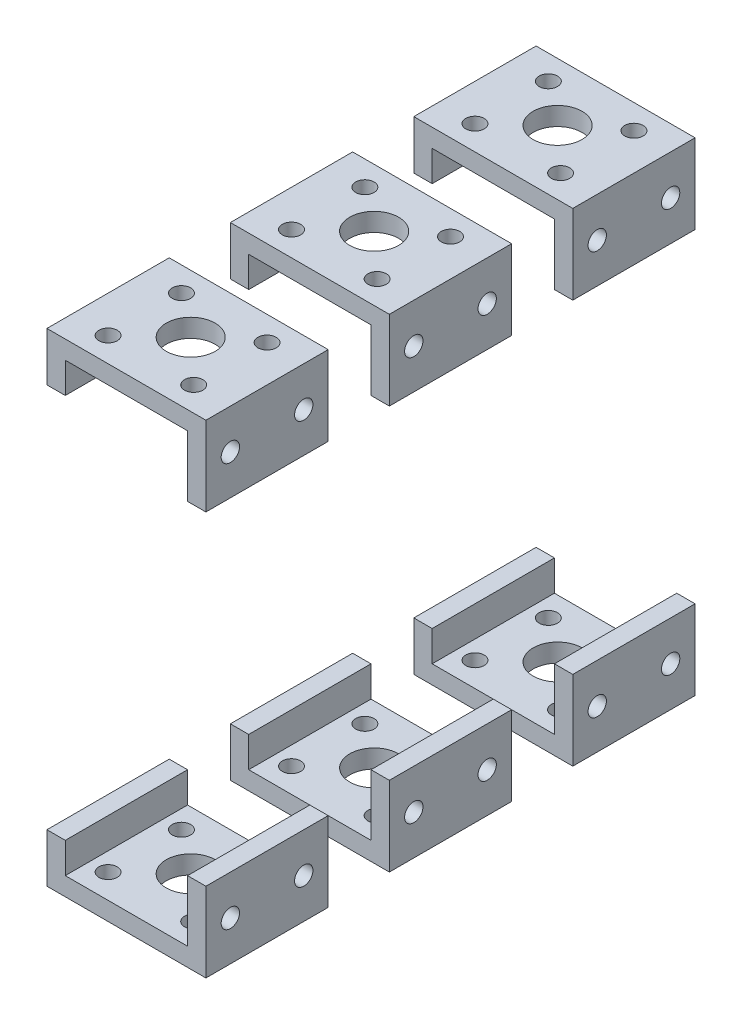
from build123d import *

# Parameters (mm, degrees)
EXTRUDE_1_DEPTH          = 160
CUT_EXTRUDE_2_DEPTH      = 167.400871392
CUT_EXTRUDE_2_DEPTH_BACK = 167.400871392
SKETCH_5_R               = 1.5
CUT_EXTRUDE_3_DEPTH      = 3
SKETCH_6_R               = 1.5
SKETCH_6_R_2             = 4
CUT_EXTRUDE_4_DEPTH      = 3


with BuildPart() as part:
    # 草图1 → 凸台-拉伸1 (new body)
    with BuildSketch(Plane.XY):
        Polygon((-8.639969484, -35.5), (-8.639969484, -39.5), (17.360030516, -39.5), (17.360030516, 39.5), (-8.639969484, 39.5), (-8.639969484, 35.5), (-8.639969484, 31.5), (-5.639969484, 31.5), (-5.639969484, 36.5), (14.360030516, 36.5), (14.360030516, -36.5), (-5.639969484, -36.5), (-5.639969484, -31.5), (-8.639969484, -31.5), align=None)
    extrude(amount=EXTRUDE_1_DEPTH)

    # 草图4 → 切除-拉伸2 (cut, two sides: drawn at the far end of the back side and taken through both)
    with BuildSketch(Plane.ZY.offset(-14.360030516).offset(-CUT_EXTRUDE_2_DEPTH_BACK)):
        Polygon((140, 26.5), (160, 26.5), (160, -26.5), (140, -26.5), (140, -45.304030301), (130, -45.304030301), (130, -26.5), (110, -26.5), (110, -45.304030301), (100, -45.304030301), (100, -26.5), (80, -26.5), (80, -45.304030301), (72.341947093, -45.304030301), (72.341947093, -47.20233834), (-21.576648983, -47.20233834), (-21.576648983, 47.202965292), (72.341947093, 47.202965292), (72.341947093, 45.304030301), (80, 45.304030301), (80, 26.5), (100, 26.5), (100, 45.304030301), (110, 45.304030301), (110, 26.5), (130, 26.5), (130, 45.304030301), (140, 45.304030301), align=None)
    extrude(amount=CUT_EXTRUDE_2_DEPTH + CUT_EXTRUDE_2_DEPTH_BACK, mode=Mode.SUBTRACT)


with BuildPart() as cut_extrude_2_piece_1:
    # of the separate pieces the step leaves, piece 1, a body of its own (cut_extrude_2_pieces)
    add(part.part.solids().sort_by_distance((17.360030516, 39.5, 80))[0])


with BuildPart() as cut_extrude_2_piece_2:
    # of the separate pieces the step leaves, piece 2, a body of its own (cut_extrude_2_pieces)
    add(part.part.solids().sort_by_distance((17.360030516, 39.5, 110))[0])


with BuildPart() as cut_extrude_2_piece_3:
    # of the separate pieces the step leaves, piece 3, a body of its own (cut_extrude_2_pieces)
    add(part.part.solids().sort_by_distance((17.360030516, -39.5, 140))[0])


with BuildPart() as cut_extrude_2_piece_4:
    # of the separate pieces the step leaves, piece 4, a body of its own (cut_extrude_2_pieces)
    add(part.part.solids().sort_by_distance((17.360030516, 39.5, 140))[0])


with BuildPart() as cut_extrude_2_piece_5:
    # of the separate pieces the step leaves, piece 5, a body of its own (cut_extrude_2_pieces)
    add(part.part.solids().sort_by_distance((17.360030516, -39.5, 110))[0])


with BuildPart() as cut_extrude_2_piece_6:
    # of the separate pieces the step leaves, piece 6, a body of its own (cut_extrude_2_pieces)
    add(part.part.solids().sort_by_distance((-8.639969484, -39.5, 80))[0])


with BuildPart() as cut_extrude_3_tool:
    # 草图5 → 切除-拉伸3 (new body)
    with BuildSketch(Plane(origin=(17.360030516, 0, 0), x_dir=(0, 0, -1), z_dir=(1, 0, 0))):
        with Locations(Location((-96, -33, 0), (0, 0, 90))):
            Circle(SKETCH_5_R)
        with Locations(Location((-84, -33, 0), (0, 0, 90))):
            Circle(SKETCH_5_R)
        with Locations(Location((-126, -33, 0), (0, 0, 90))):
            Circle(SKETCH_5_R)
        with Locations(Location((-114, -33, 0), (0, 0, 90))):
            Circle(SKETCH_5_R)
        with Locations(Location((-156, -33, 0), (0, 0, 90))):
            Circle(SKETCH_5_R)
        with Locations(Location((-144, -33, 0), (0, 0, 90))):
            Circle(SKETCH_5_R)
        with Locations((-84, 33)):
            Circle(SKETCH_5_R)
        with Locations((-96, 33)):
            Circle(SKETCH_5_R)
        with Locations((-114, 33)):
            Circle(SKETCH_5_R)
        with Locations((-126, 33)):
            Circle(SKETCH_5_R)
        with Locations((-144, 33)):
            Circle(SKETCH_5_R)
        with Locations((-156, 33)):
            Circle(SKETCH_5_R)
    extrude(amount=-CUT_EXTRUDE_3_DEPTH)


with BuildPart() as cut_extrude_2_piece_1_1:
    add(cut_extrude_2_piece_1.part)

    # 切除-拉伸3: cut by cut_extrude_3_tool
    add(cut_extrude_3_tool.part, mode=Mode.SUBTRACT)


with BuildPart() as cut_extrude_2_piece_2_1:
    add(cut_extrude_2_piece_2.part)

    # 切除-拉伸3: cut by cut_extrude_3_tool
    add(cut_extrude_3_tool.part, mode=Mode.SUBTRACT)


with BuildPart() as cut_extrude_2_piece_3_1:
    add(cut_extrude_2_piece_3.part)

    # 切除-拉伸3: cut by cut_extrude_3_tool
    add(cut_extrude_3_tool.part, mode=Mode.SUBTRACT)


with BuildPart() as cut_extrude_2_piece_4_1:
    add(cut_extrude_2_piece_4.part)

    # 切除-拉伸3: cut by cut_extrude_3_tool
    add(cut_extrude_3_tool.part, mode=Mode.SUBTRACT)


with BuildPart() as cut_extrude_2_piece_5_1:
    add(cut_extrude_2_piece_5.part)

    # 切除-拉伸3: cut by cut_extrude_3_tool
    add(cut_extrude_3_tool.part, mode=Mode.SUBTRACT)


with BuildPart() as cut_extrude_2_piece_6_1:
    add(cut_extrude_2_piece_6.part)

    # 切除-拉伸3: cut by cut_extrude_3_tool
    add(cut_extrude_3_tool.part, mode=Mode.SUBTRACT)


with BuildPart() as cut_extrude_4_tool:
    # 草图6 → 切除-拉伸4 (new body)
    with BuildSketch(Plane.XZ.offset(39.5)):
        with Locations((11.360030516, 96)):
            Circle(SKETCH_6_R)
        with Locations((11.360030516, 84)):
            Circle(SKETCH_6_R)
        with Locations((-2.639969484, 84)):
            Circle(SKETCH_6_R)
        with Locations((-2.639969484, 96)):
            Circle(SKETCH_6_R)
        with Locations((-2.639969484, 126)):
            Circle(SKETCH_6_R)
        with Locations((-2.639969484, 114)):
            Circle(SKETCH_6_R)
        with Locations((11.360030516, 114)):
            Circle(SKETCH_6_R)
        with Locations((11.360030516, 126)):
            Circle(SKETCH_6_R)
        with Locations((-2.639969484, 156)):
            Circle(SKETCH_6_R)
        with Locations((-2.639969484, 144)):
            Circle(SKETCH_6_R)
        with Locations((11.360030516, 144)):
            Circle(SKETCH_6_R)
        with Locations((11.360030516, 156)):
            Circle(SKETCH_6_R)
        with Locations((4.360030516, 89.485879771)):
            Circle(SKETCH_6_R_2)
        with Locations((4.360030516, 119.485879771)):
            Circle(SKETCH_6_R_2)
        with Locations((4.360030516, 149.485879771)):
            Circle(SKETCH_6_R_2)
    cut_extrude_4 = extrude(amount=-CUT_EXTRUDE_4_DEPTH)


with BuildPart() as cut_extrude_2_piece_3_2:
    add(cut_extrude_2_piece_3_1.part)

    # 切除-拉伸4: cut by cut_extrude_4_tool
    add(cut_extrude_4_tool.part, mode=Mode.SUBTRACT)


with BuildPart() as cut_extrude_2_piece_5_2:
    add(cut_extrude_2_piece_5_1.part)

    # 切除-拉伸4: cut by cut_extrude_4_tool
    add(cut_extrude_4_tool.part, mode=Mode.SUBTRACT)


with BuildPart() as cut_extrude_2_piece_6_2:
    add(cut_extrude_2_piece_6_1.part)

    # 切除-拉伸4: cut by cut_extrude_4_tool
    add(cut_extrude_4_tool.part, mode=Mode.SUBTRACT)


with BuildPart() as mirror_1_tool:
    # 镜向1: 切除-拉伸4 across plane
    add(cut_extrude_4.mirror(Plane.ZX))


with BuildPart() as cut_extrude_2_piece_1_2:
    add(cut_extrude_2_piece_1_1.part)

    # 镜向1: cut by mirror_1_tool
    add(mirror_1_tool.part, mode=Mode.SUBTRACT)


with BuildPart() as cut_extrude_2_piece_2_2:
    add(cut_extrude_2_piece_2_1.part)

    # 镜向1: cut by mirror_1_tool
    add(mirror_1_tool.part, mode=Mode.SUBTRACT)


with BuildPart() as cut_extrude_2_piece_4_2:
    add(cut_extrude_2_piece_4_1.part)

    # 镜向1: cut by mirror_1_tool
    add(mirror_1_tool.part, mode=Mode.SUBTRACT)


solid = Compound([cut_extrude_2_piece_3_2.part, cut_extrude_2_piece_5_2.part, cut_extrude_2_piece_6_2.part, cut_extrude_2_piece_1_2.part, cut_extrude_2_piece_2_2.part, cut_extrude_2_piece_4_2.part])
